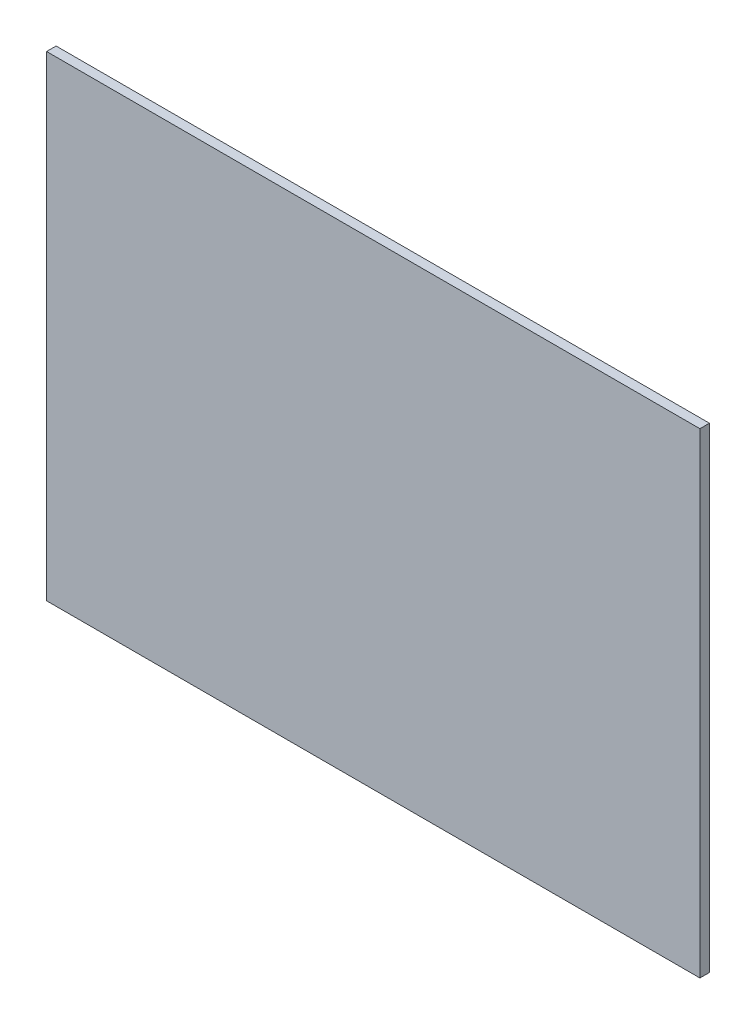
from build123d import *

# Parameters (mm, degrees)
SKETCH1_W           = 206
SKETCH1_H           = 150
BOSS_EXTRUDE1_DEPTH = 3


with BuildPart() as part:
    # Sketch1 → Boss-Extrude1 (new body)
    with BuildSketch(Plane.XY):
        Rectangle(SKETCH1_W, SKETCH1_H)
    extrude(amount=BOSS_EXTRUDE1_DEPTH)


solid = part.part
